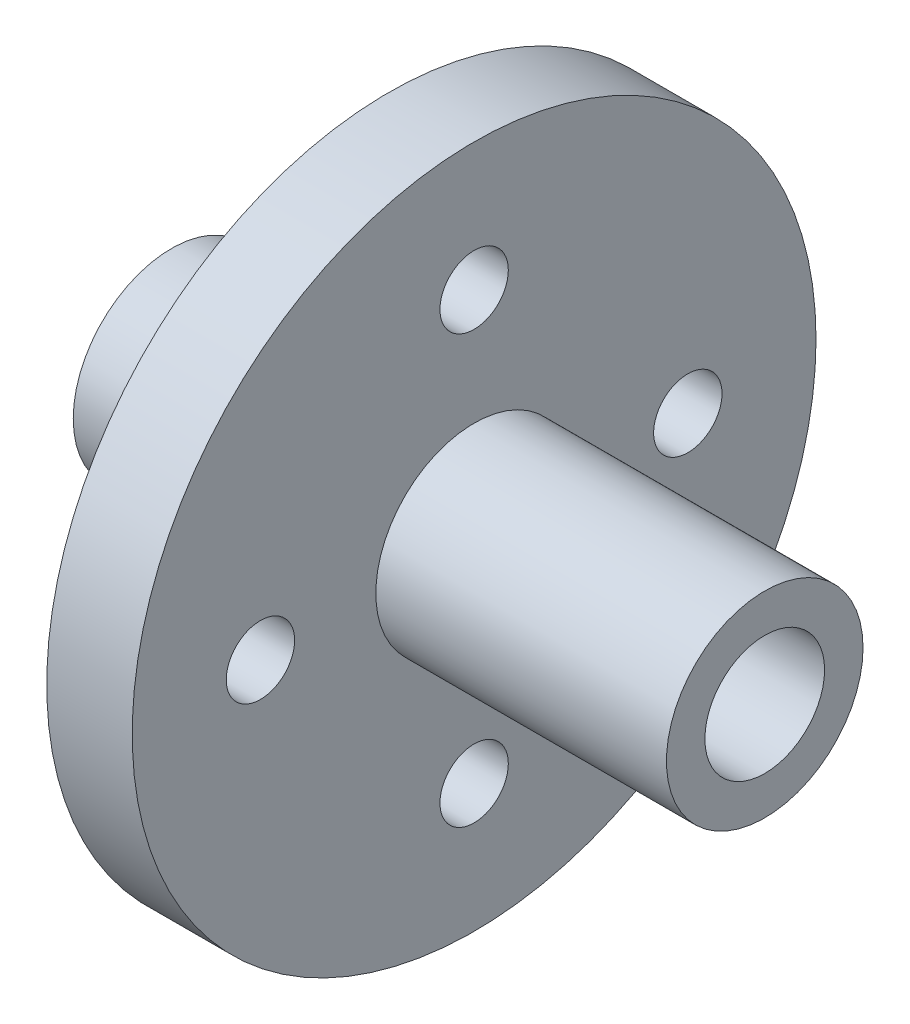
from build123d import *

# Parameters (mm, degrees)
SKETCH1_R                    = 20
SKETCH1_R_2                  = 3.5
BOSS_EXTRUDE1_DEPTH          = 5
BOSS_EXTRUDE2_DEPTH          = 12.7
BOSS_EXTRUDE2_DEPTH_BACK     = 22
SKETCH3_R                    = 5.75
SKETCH3_R_2                  = 3.5
F_4_0_4_DIAMETER_HOLE1_D     = 4
F_4_0_4_DIAMETER_HOLE1_DEPTH = 15
F_4_0_4_DIAMETER_HOLE1_TIP   = 1.201721238


with BuildPart() as part:
    # Sketch1 → Boss-Extrude1 (new body)
    with BuildSketch(Plane(origin=(0, 0, 0), x_dir=(0, 0, -1), z_dir=(1, 0, 0))):
        Circle(SKETCH1_R)
        Circle(SKETCH1_R_2, mode=Mode.SUBTRACT)
    extrude(amount=BOSS_EXTRUDE1_DEPTH)

    # Sketch3 → Boss-Extrude2 (add, two sides: drawn at the far end of the back side and taken through both)
    with BuildSketch(Plane.ZY.offset(-BOSS_EXTRUDE2_DEPTH_BACK)):
        Circle(SKETCH3_R)
        Circle(SKETCH3_R_2, mode=Mode.SUBTRACT)
    extrude(amount=BOSS_EXTRUDE2_DEPTH + BOSS_EXTRUDE2_DEPTH_BACK)

    # Ø4.0 (4) Diameter Hole1
    with Locations(Plane(origin=(5, 0, 0), x_dir=(0, 0, -1), z_dir=(1, 0, 0))):
        with Locations((12.5, 0), (0, -12.5), (-12.5, 0), (0, 12.5)):
            Hole(F_4_0_4_DIAMETER_HOLE1_D / 2, depth=F_4_0_4_DIAMETER_HOLE1_DEPTH)
            with Locations((0, 0, -(F_4_0_4_DIAMETER_HOLE1_DEPTH + F_4_0_4_DIAMETER_HOLE1_TIP / 2))):  # 118° drill point
                Cone(0, F_4_0_4_DIAMETER_HOLE1_D / 2, F_4_0_4_DIAMETER_HOLE1_TIP, mode=Mode.SUBTRACT)


solid = part.part
